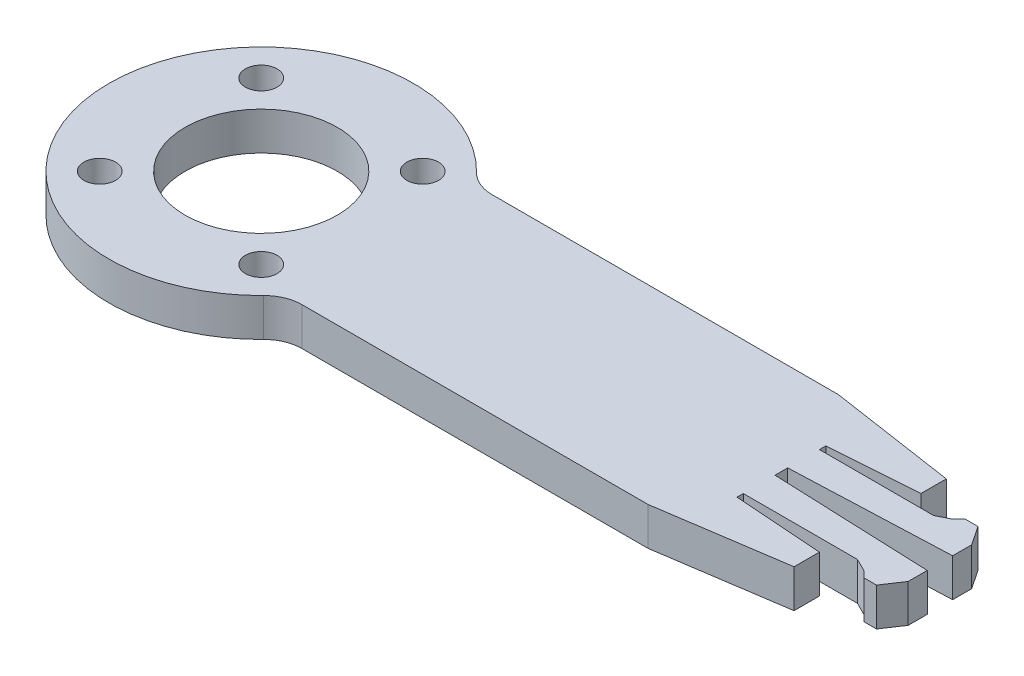
from build123d import *

# Parameters (mm, degrees)
SKETCH1_R           = 6
SKETCH1_R_2         = 1.25
BOSS_EXTRUDE1_DEPTH = 1.5
FILLET1_R           = 3


with BuildPart() as part:
    # Sketch1 → Boss-Extrude1 (new, symmetric)
    with BuildSketch(Plane(origin=(0, 0, 0), x_dir=(1, 0, 0), z_dir=(0, 1, 0))):
        with BuildLine():
            Line((9.367496998, 7.5), (38, 7.5))
            Line((38, 7.5), (48, 6))
            Line((48, 6), (48, 4))
            Line((48, 4), (41, 3.5))
            Line((41, 3.5), (41, 3))
            Line((41, 3), (50, 3))
            Line((50, 3), (51, 3.5))
            Line((51, 3.5), (51.5, 4))
            Line((51.5, 4), (52.5, 4))
            Line((52.5, 4), (53.5, 2.5))
            Line((53.5, 2.5), (53.5, 1))
            Line((53.5, 1), (41, 0.5))
            Line((41, 0.5), (41, -0.5))
            Line((41, -0.5), (53.5, -1))
            Line((53.5, -1), (53.5, -2.5))
            Line((53.5, -2.5), (52.5, -4))
            Line((52.5, -4), (51.5, -4))
            Line((51.5, -4), (51, -3.5))
            Line((51, -3.5), (50, -3))
            Line((50, -3), (41, -3))
            Line((41, -3), (41, -3.5))
            Line((41, -3.5), (48, -4))
            Line((48, -4), (48, -6))
            Line((48, -6), (38, -7.5))
            Line((38, -7.5), (9.367496998, -7.5))
            ThreePointArc((9.367496998, -7.5), (-12, 0), (9.367496998, 7.5))
        make_face()
        with Locations(Location((0, 0, 0), (0, 0, 270))):
            Circle(SKETCH1_R, mode=Mode.SUBTRACT)
        with Locations(Location((6.363961031, 6.363961031, 0), (0, 0, 270))):
            Circle(SKETCH1_R_2, mode=Mode.SUBTRACT)
        with Locations(Location((-6.363961031, 6.363961031, 0), (0, 0, 270))):
            Circle(SKETCH1_R_2, mode=Mode.SUBTRACT)
        with Locations(Location((-6.363961031, -6.363961031, 0), (0, 0, 270))):
            Circle(SKETCH1_R_2, mode=Mode.SUBTRACT)
        with Locations(Location((6.363961031, -6.363961031, 0), (0, 0, 270))):
            Circle(SKETCH1_R_2, mode=Mode.SUBTRACT)
    extrude(amount=BOSS_EXTRUDE1_DEPTH, both=True)

    # Fillet1
    fillet1_edges = [part.edges().sort_by_distance(p)[0] for p in [
        (9.367496998, 0, 7.5),
        (9.367496998, 0, -7.5),
    ]]
    fillet(fillet1_edges, radius=FILLET1_R)


solid = part.part
